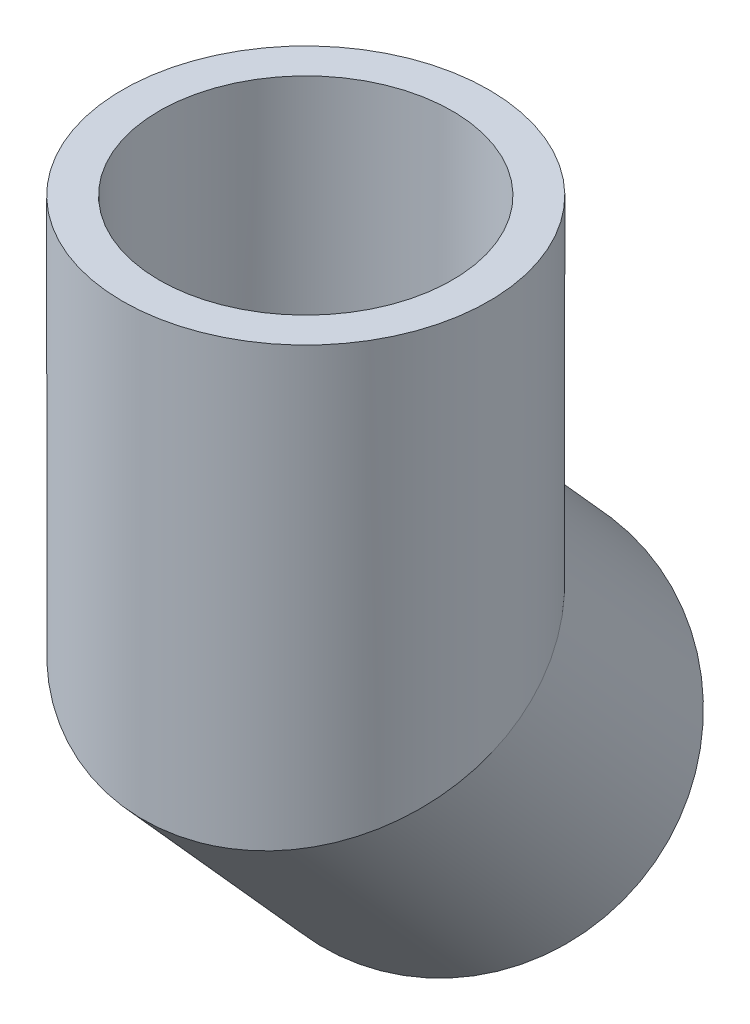
from build123d import *

# Parameters (mm, degrees)
SKETCH_2_R   = 12.5
SKETCH_2_R_2 = 10


with BuildPart() as part:
    # 扫描1: sweep along a curve in space
    with BuildLine() as sweep_1_path:
        Line((0, 0, 0), (0, -25, 0))
        Line((0, -25, 0), (-6.306035323, -42.67766953, -16.514657686))
    # 草图2 → 扫描1 (sweep)
    with BuildSketch(Plane(origin=(0, 0, 0), x_dir=(1, 0, 0), z_dir=(0, 1, 0))):
        Circle(SKETCH_2_R)
        Circle(SKETCH_2_R_2, mode=Mode.SUBTRACT)
    sweep(path=sweep_1_path.line, transition=Transition.RIGHT)


solid = part.part
